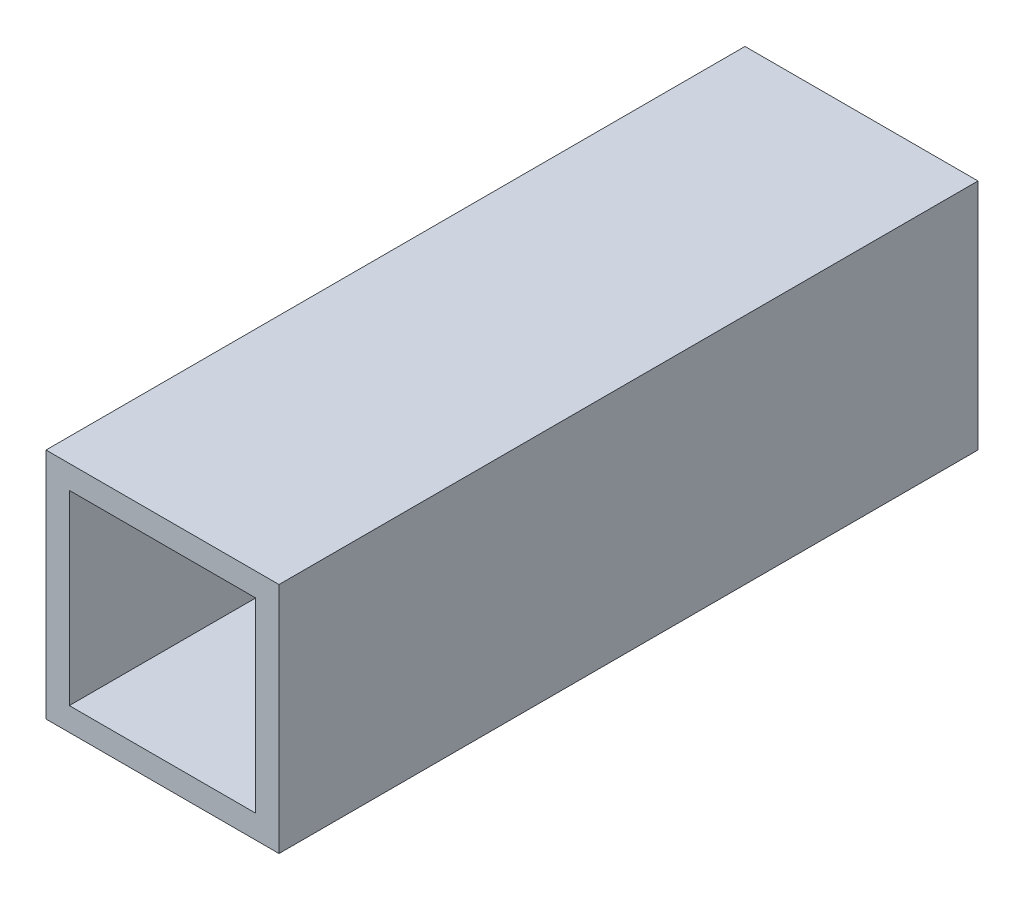
from build123d import *

# Parameters (mm, degrees)
SKETCH1_W           = 50
SKETCH1_H           = 50
SKETCH1_W_2         = 40
SKETCH1_H_2         = 40
BOSS_EXTRUDE1_DEPTH = 150


with BuildPart() as part:
    # Sketch1 → Boss-Extrude1 (new body)
    with BuildSketch(Plane.XY):
        Rectangle(SKETCH1_W, SKETCH1_H)
        Rectangle(SKETCH1_W_2, SKETCH1_H_2, mode=Mode.SUBTRACT)
    extrude(amount=BOSS_EXTRUDE1_DEPTH)


solid = part.part
